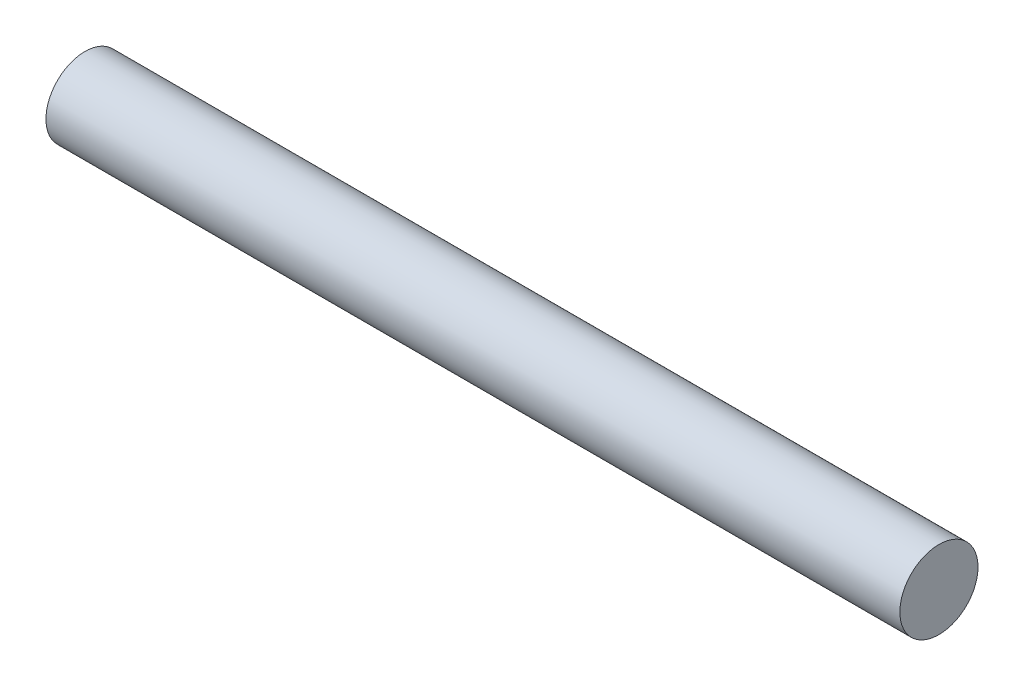
from build123d import *

# Parameters (mm, degrees)
SKETCH2_R          = 3.5
BASE_EXTRUDE_DEPTH = 76.5


with BuildPart() as part:
    # Sketch2 → Base-Extrude (new body)
    with BuildSketch(Plane(origin=(0, 0, 0), x_dir=(0, 0, -1), z_dir=(1, 0, 0))):
        Circle(SKETCH2_R)
    extrude(amount=BASE_EXTRUDE_DEPTH)


solid = part.part
